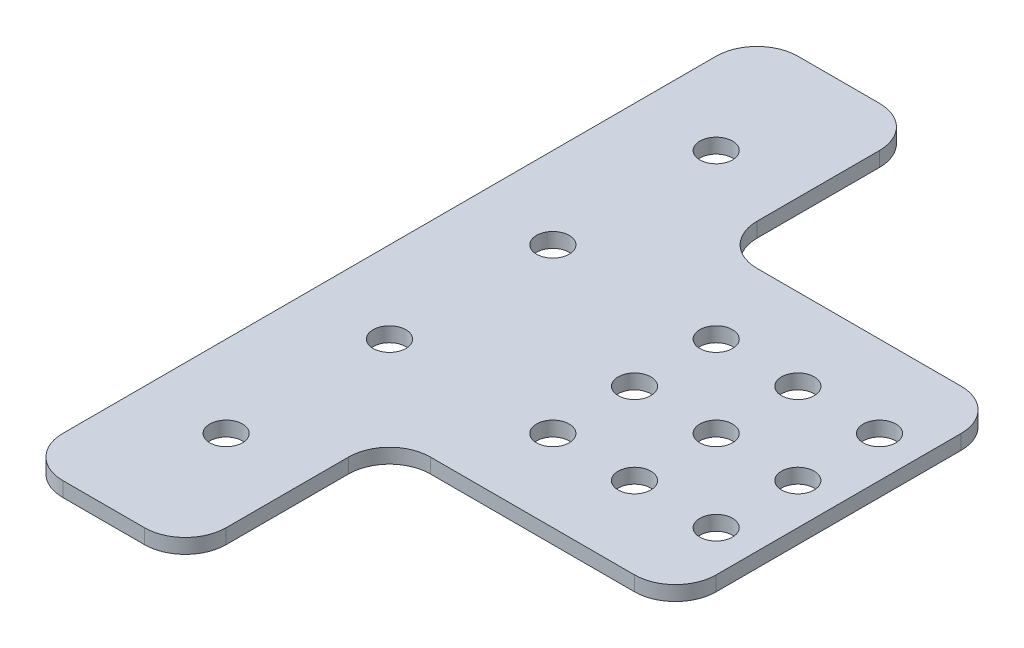
from build123d import *

# Parameters (mm, degrees)
SKETCH1_R           = 2.54
BOSS_EXTRUDE1_DEPTH = 2.286
FILLET1_R           = 6.35


with BuildPart() as part:
    # Sketch1 → Boss-Extrude1 (new body)
    with BuildSketch(Plane(origin=(0, 0, 0), x_dir=(1, 0, 0), z_dir=(0, 1, 0))):
        Polygon((25.4, 114.3), (0, 114.3), (0, 0), (25.4, 0), (25.4, 31.75), (69.85, 31.75), (69.85, 82.55), (25.4, 82.55), align=None)
        with Locations(Location((12.7, 95.25, 0), (0, 0, 270))):
            Circle(SKETCH1_R, mode=Mode.SUBTRACT)
        with Locations(Location((12.7, 69.85, 0), (0, 0, 270))):
            Circle(SKETCH1_R, mode=Mode.SUBTRACT)
        with Locations(Location((12.7, 44.45, 0), (0, 0, 270))):
            Circle(SKETCH1_R, mode=Mode.SUBTRACT)
        with Locations(Location((12.7, 19.05, 0), (0, 0, 270))):
            Circle(SKETCH1_R, mode=Mode.SUBTRACT)
        with Locations(Location((38.1, 69.85, 0), (0, 0, 270))):
            Circle(SKETCH1_R, mode=Mode.SUBTRACT)
        with Locations(Location((50.8, 69.85, 0), (0, 0, 270))):
            Circle(SKETCH1_R, mode=Mode.SUBTRACT)
        with Locations(Location((63.5, 69.85, 0), (0, 0, 270))):
            Circle(SKETCH1_R, mode=Mode.SUBTRACT)
        with Locations(Location((50.8, 57.15, 0), (0, 0, 270))):
            Circle(SKETCH1_R, mode=Mode.SUBTRACT)
        with Locations(Location((63.5, 57.15, 0), (0, 0, 270))):
            Circle(SKETCH1_R, mode=Mode.SUBTRACT)
        with Locations(Location((50.8, 44.45, 0), (0, 0, 270))):
            Circle(SKETCH1_R, mode=Mode.SUBTRACT)
        with Locations(Location((63.5, 44.45, 0), (0, 0, 270))):
            Circle(SKETCH1_R, mode=Mode.SUBTRACT)
        with Locations(Location((38.1, 57.15, 0), (0, 0, 270))):
            Circle(SKETCH1_R, mode=Mode.SUBTRACT)
        with Locations(Location((38.1, 44.45, 0), (0, 0, 270))):
            Circle(SKETCH1_R, mode=Mode.SUBTRACT)
    extrude(amount=BOSS_EXTRUDE1_DEPTH)

    # Fillet1
    fillet1_edges = [part.edges().sort_by_distance(p)[0] for p in [
        (25.4, 1.143, -82.55),
        (69.85, 1.143, -82.55),
        (69.85, 1.143, -31.75),
        (25.4, 1.143, -31.75),
        (25.4, 1.143, 0),
        (0, 1.143, 0),
        (0, 1.143, -114.3),
        (25.4, 1.143, -114.3),
    ]]
    fillet(fillet1_edges, radius=FILLET1_R)


solid = part.part
